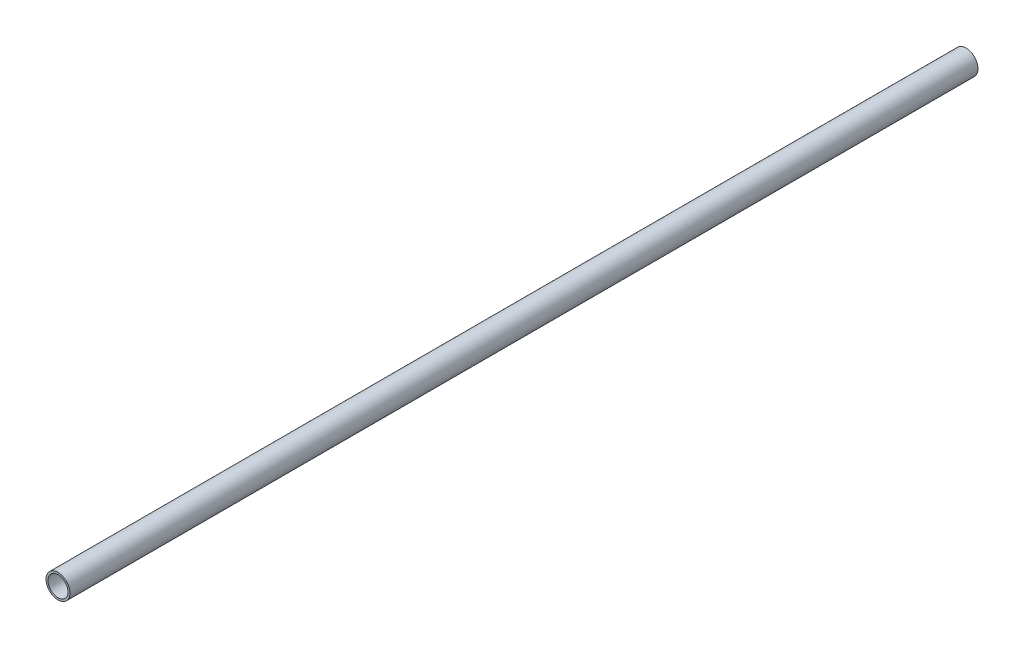
from build123d import *

# Parameters (mm, degrees)
SKETCH1_R           = 24.13
SKETCH1_R_2         = 20.193
BOSS_EXTRUDE1_DEPTH = 1828.8


with BuildPart() as part:
    # Sketch1 → Boss-Extrude1 (new body)
    with BuildSketch(Plane.XY):
        Circle(SKETCH1_R)
        Circle(SKETCH1_R_2, mode=Mode.SUBTRACT)
    extrude(amount=BOSS_EXTRUDE1_DEPTH)


solid = part.part
